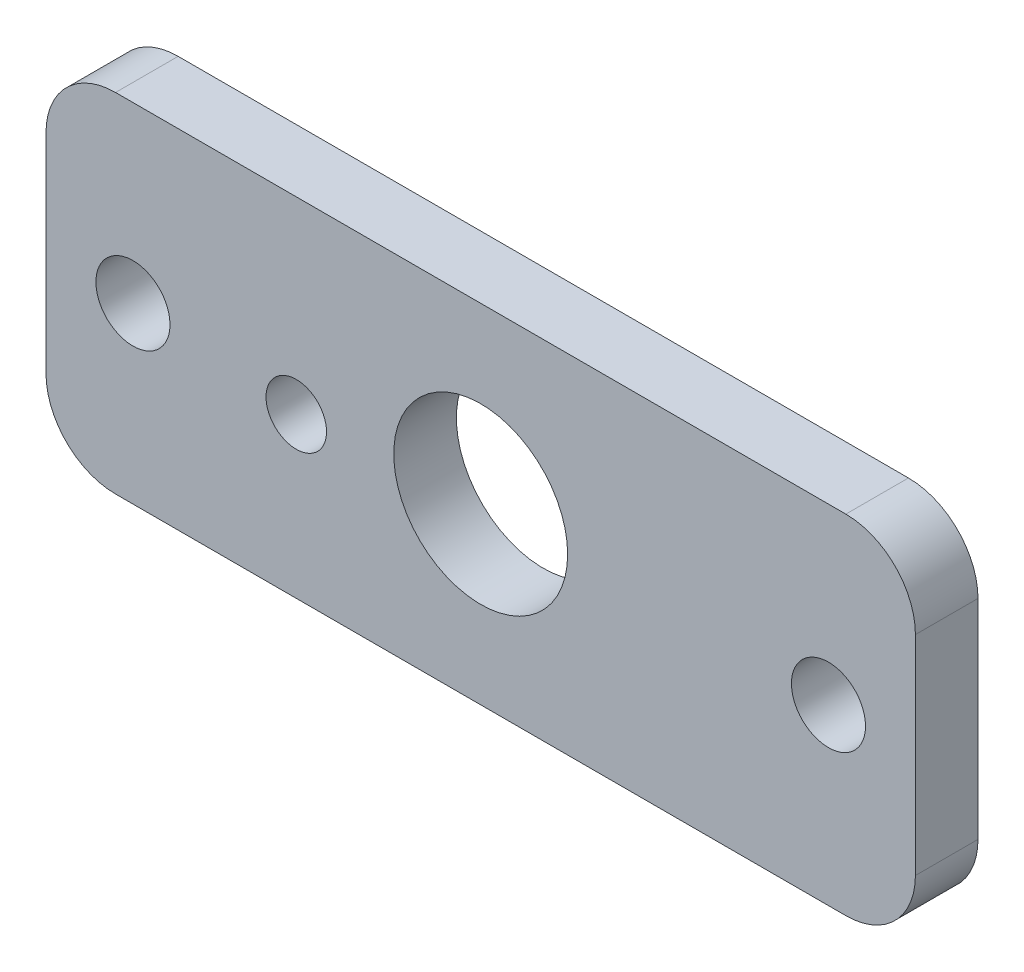
from build123d import *

# Parameters (mm, degrees)
SKETCH1_W             = 31.75
SKETCH1_H             = 12.7
BOSS_EXTRUDE1_DEPTH   = 2.286
FILLET1_R             = 2.54
SKETCH2_R             = 3.175
SKETCH2_R_2           = 1.1049
CUT_EXTRUDE1_DEPTH    = 174.210169025
F_2_CLEARANCE_HOLE1_D = 2.7051


with BuildPart() as part:
    # Sketch1 → Boss-Extrude1 (new body)
    with BuildSketch(Plane.XY):
        with Locations((-1.87e-07, -166.116000205)):
            Rectangle(SKETCH1_W, SKETCH1_H)
    extrude(amount=BOSS_EXTRUDE1_DEPTH)

    # Fillet1
    fillet1_edges = [part.edges().sort_by_distance(p)[0] for p in [
        (15.874999813, -172.466000205, 1.143),
        (-15.875000187, -172.466000205, 1.143),
        (-15.875000187, -159.766000205, 1.143),
        (15.874999813, -159.766000205, 1.143),
    ]]
    fillet(fillet1_edges, radius=FILLET1_R)

    # Sketch2 → Cut-Extrude1 (cut, through all)
    with BuildSketch(Plane.XY.offset(2.286)):
        with Locations((-1.87e-07, -166.116000205)):
            Circle(SKETCH2_R)
        with Locations((-6.735572471, -166.64610111)):
            Circle(SKETCH2_R_2)
    extrude(amount=-CUT_EXTRUDE1_DEPTH, mode=Mode.SUBTRACT)

    # #2 Clearance Hole1 (through all)
    with Locations(Plane.XY.offset(2.286)):
        with Locations((12.699999906, -166.116000205), (-12.700000094, -166.116000205)):
            Hole(F_2_CLEARANCE_HOLE1_D / 2)


solid = part.part
